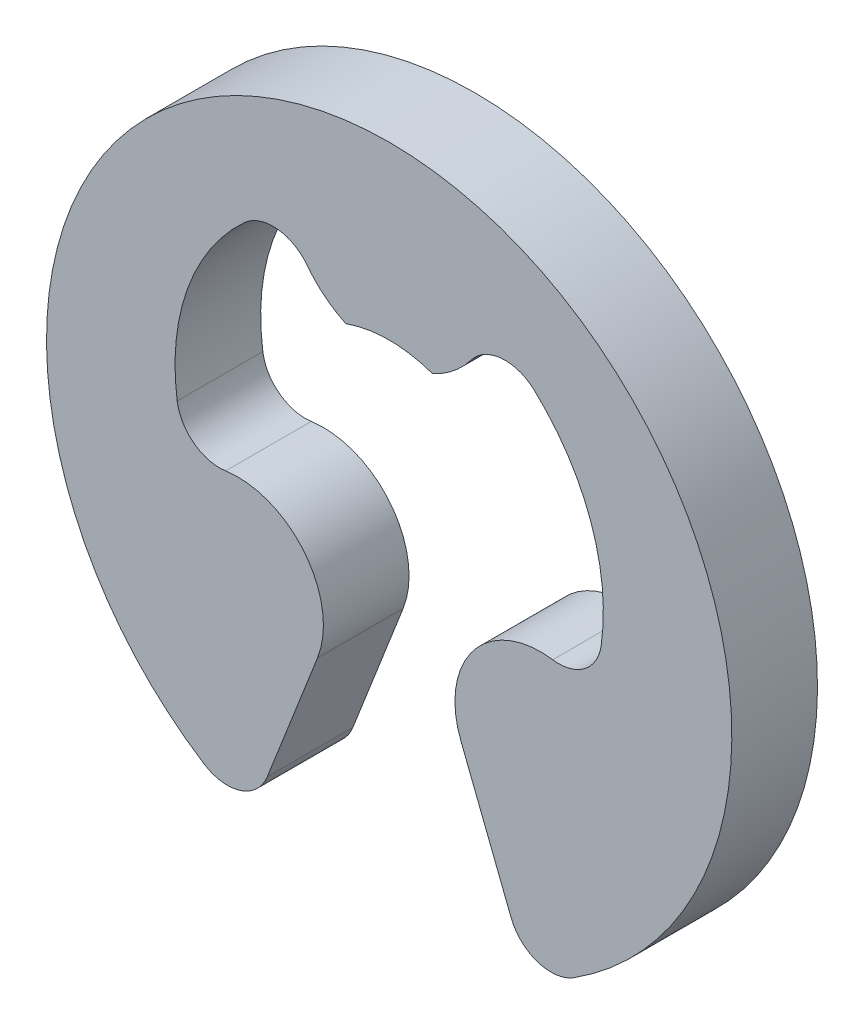
from build123d import *

# Parameters (mm, degrees)
BOSS_EXTRU_1_DEPTH = 0.5


with BuildPart() as part:
    # Esquisse1 → Boss.-Extru.1 (new body)
    with BuildSketch(Plane.XY):
        with BuildLine():
            Line((-0.418425085, -1.066499155), (-0.711880974, -1.814471655))
            ThreePointArc((-0.711880974, -1.814471655), (-0.867543301, -1.960988747), (-1.079554479, -1.933615789))
            ThreePointArc((-1.079554479, -1.933615789), (0, 1.75), (1.079554479, -1.933615789))
            ThreePointArc((1.079554479, -1.933615789), (0.867543301, -1.960988747), (0.711880974, -1.814471655))
            Line((0.711880974, -1.814471655), (0.418425085, -1.066499155))
            ThreePointArc((0.418425085, -1.066499155), (0.49178829, -0.57362332), (0.954594155, -0.38890873))
            ThreePointArc((0.954594155, -0.38890873), (1.139949494, -0.341421356), (1.237436867, -0.176776695))
            ThreePointArc((1.237436867, -0.176776695), (1.177345945, 0.419948242), (0.84622692, 0.92))
            ThreePointArc((0.84622692, 0.92), (0.654792508, 0.985013347), (0.477869319, 0.887176471))
            ThreePointArc((0.477869319, 0.887176471), (0.376548051, 0.782868792), (0.253108672, 0.706))
            ThreePointArc((0.253108672, 0.706), (0, 0.75), (-0.253108672, 0.706))
            ThreePointArc((-0.253108672, 0.706), (-0.376548051, 0.782868792), (-0.477869319, 0.887176471))
            ThreePointArc((-0.477869319, 0.887176471), (-0.654792508, 0.985013347), (-0.84622692, 0.92))
            ThreePointArc((-0.84622692, 0.92), (-1.177345945, 0.419948242), (-1.237436867, -0.176776695))
            ThreePointArc((-1.237436867, -0.176776695), (-1.139949494, -0.341421356), (-0.954594155, -0.38890873))
            ThreePointArc((-0.954594155, -0.38890873), (-0.49178829, -0.57362332), (-0.418425085, -1.066499155))
        make_face()
    extrude(amount=BOSS_EXTRU_1_DEPTH)


solid = part.part
